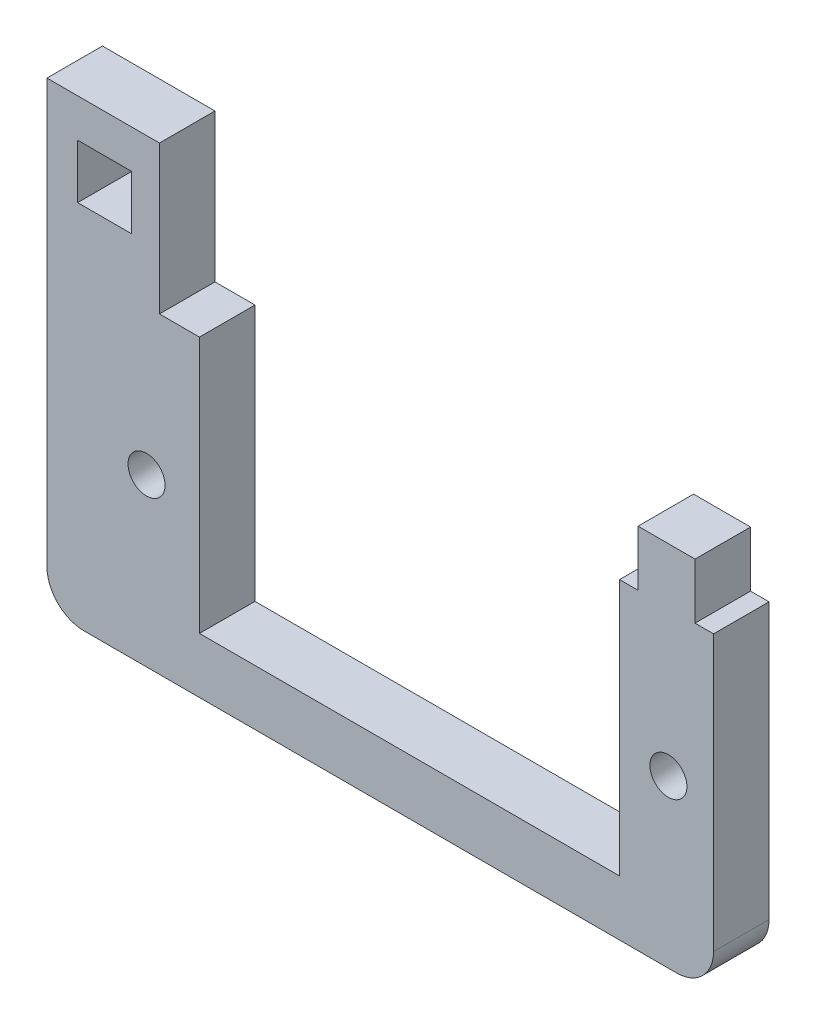
from build123d import *

# Parameters (mm, degrees)
SKETCH1_R           = 1
SKETCH1_W           = 2.92
SKETCH1_H           = 2.92
BOSS_EXTRUDE1_DEPTH = 3
FILLET1_R           = 2


with BuildPart() as part:
    # Sketch1 → Boss-Extrude1 (new body)
    with BuildSketch(Plane.XY):
        Polygon((28.185405405, -11.518648649), (-7.836756757, -11.518648649), (-7.836756757, 13.351351351), (-1.756756757, 13.351351351), (-1.756756757, 5.351351351), (0.405405405, 5.351351351), (0.405405405, -8.518648649), (23.105405405, -8.518648649), (23.105405405, 5.351351351), (24.105405405, 5.351351351), (24.105405405, 8.351351351), (27.185405405, 8.351351351), (27.185405405, 5.351351351), (28.185405405, 5.351351351), align=None)
        with Locations((-2.454594595, -2.518648649)):
            Circle(SKETCH1_R, mode=Mode.SUBTRACT)
        with Locations((25.745405405, -2.518648649)):
            Circle(SKETCH1_R, mode=Mode.SUBTRACT)
        with Locations((-4.716756757, 9.811351351)):
            Rectangle(SKETCH1_W, SKETCH1_H, mode=Mode.SUBTRACT)
    extrude(amount=BOSS_EXTRUDE1_DEPTH)

    # Fillet1
    fillet1_edges = [part.edges().sort_by_distance(p)[0] for p in [
        (28.185405405, -11.518648649, 1.5),
        (-7.836756757, -11.518648649, 1.5),
    ]]
    fillet(fillet1_edges, radius=FILLET1_R)


solid = part.part
